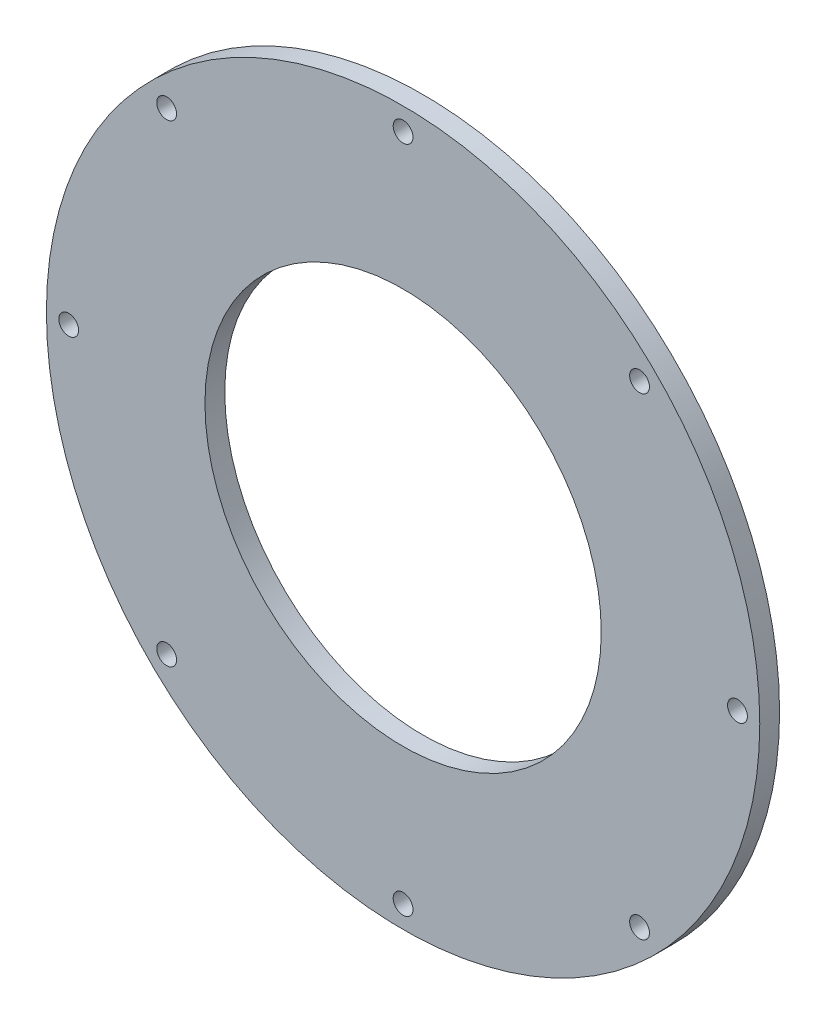
from build123d import *

# Parameters (mm, degrees)
SKETCH_1_R      = 72
SKETCH_1_R_2    = 40
SKETCH_1_R_3    = 2
EXTRUDE_1_DEPTH = 4


with BuildPart() as part:
    # 草图1 → 凸台-拉伸1 (new body)
    with BuildSketch(Plane.XY):
        Circle(SKETCH_1_R)
        Circle(SKETCH_1_R_2, mode=Mode.SUBTRACT)
        with Locations((0, -67.5)):
            Circle(SKETCH_1_R_3, mode=Mode.SUBTRACT)
        with Locations((-47.72970773, -47.72970773)):
            Circle(SKETCH_1_R_3, mode=Mode.SUBTRACT)
        with Locations((-67.5, 0)):
            Circle(SKETCH_1_R_3, mode=Mode.SUBTRACT)
        with Locations((-47.72970773, 47.72970773)):
            Circle(SKETCH_1_R_3, mode=Mode.SUBTRACT)
        with Locations((0, 67.5)):
            Circle(SKETCH_1_R_3, mode=Mode.SUBTRACT)
        with Locations((47.72970773, 47.72970773)):
            Circle(SKETCH_1_R_3, mode=Mode.SUBTRACT)
        with Locations((67.5, 0)):
            Circle(SKETCH_1_R_3, mode=Mode.SUBTRACT)
        with Locations((47.72970773, -47.72970773)):
            Circle(SKETCH_1_R_3, mode=Mode.SUBTRACT)
    extrude(amount=EXTRUDE_1_DEPTH)


solid = part.part
